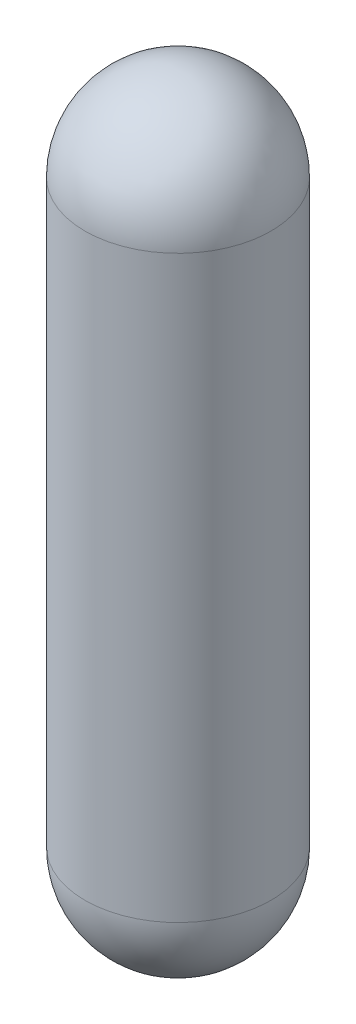
from build123d import *

# Parameters (mm, degrees)
SCHIZZO1_R                   = 7
ESTRUSIONE_ESTRUSIONE1_DEPTH = 43.6
RIVOLUZIONE1_ANGLE           = 180
RIVOLUZIONE2_ANGLE           = 180


with BuildPart() as part:
    # Schizzo1 → Estrusione-Estrusione1 (new body)
    with BuildSketch(Plane(origin=(0, 0, 0), x_dir=(1, 0, 0), z_dir=(0, 1, 0))):
        with Locations(Location((0, 0, 0), (0, 0, 270))):
            Circle(SCHIZZO1_R)
    extrude(amount=ESTRUSIONE_ESTRUSIONE1_DEPTH)

    # Schizzo2 → Rivoluzione1 (revolve)
    with BuildSketch(Plane(origin=(0, 0, 0), x_dir=(-1, 0, 0), z_dir=(0, -1, 0))):
        with BuildLine():
            Line((-0.415700634, -6.98764574), (0.415700634, 6.98764574))
            ThreePointArc((0.415700634, 6.98764574), (-6.98764574, 0.415700634), (-0.415700634, -6.98764574))
        make_face()
    revolve(axis=Axis((0.415700634, 0, 6.98764574), (-0.05938580489346364, 0, -0.9982351056625666)), revolution_arc=RIVOLUZIONE1_ANGLE)

    # Schizzo3 → Rivoluzione2 (revolve)
    with BuildSketch(Plane(origin=(0, 43.6, 0), x_dir=(1, 0, 0), z_dir=(0, 1, 0))):
        with BuildLine():
            Line((7, 0), (-7, 0))
            ThreePointArc((-7, 0), (0, -7), (7, 0))
        make_face()
    revolve(axis=Axis((7, 43.6, 0), (-1, 0, 0)), revolution_arc=RIVOLUZIONE2_ANGLE)


solid = part.part
